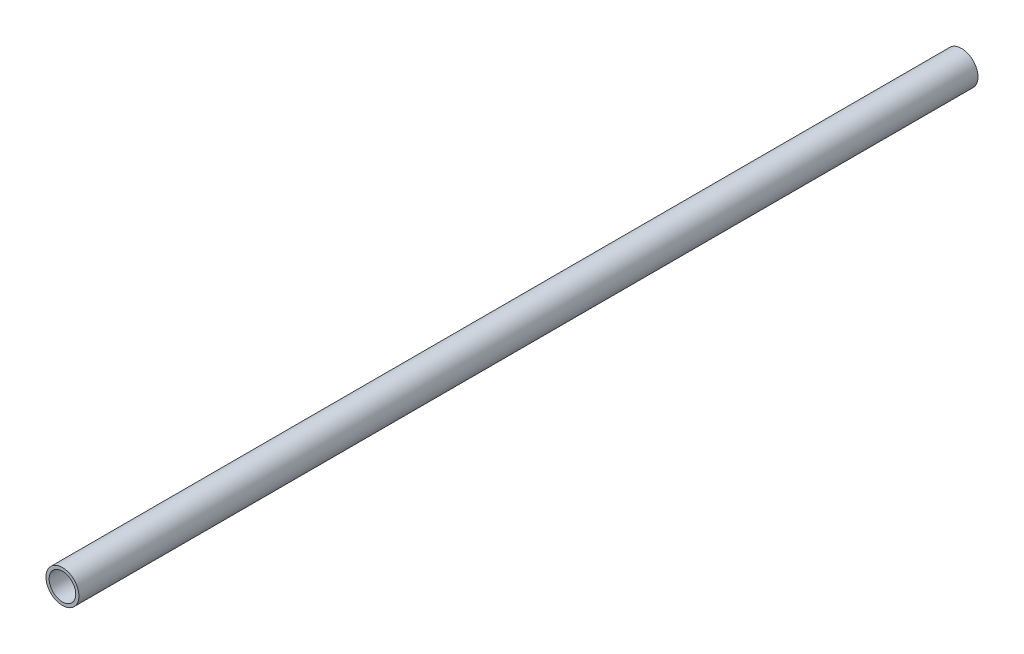
from build123d import *

# Parameters (mm, degrees)
SKETCH1_R           = 5
SKETCH1_R_2         = 4.05
BOSS_EXTRUDE1_DEPTH = 273


with BuildPart() as part:
    # Sketch1 → Boss-Extrude1 (new body)
    with BuildSketch(Plane.XY):
        Circle(SKETCH1_R)
        Circle(SKETCH1_R_2, mode=Mode.SUBTRACT)
    extrude(amount=BOSS_EXTRUDE1_DEPTH)


solid = part.part
